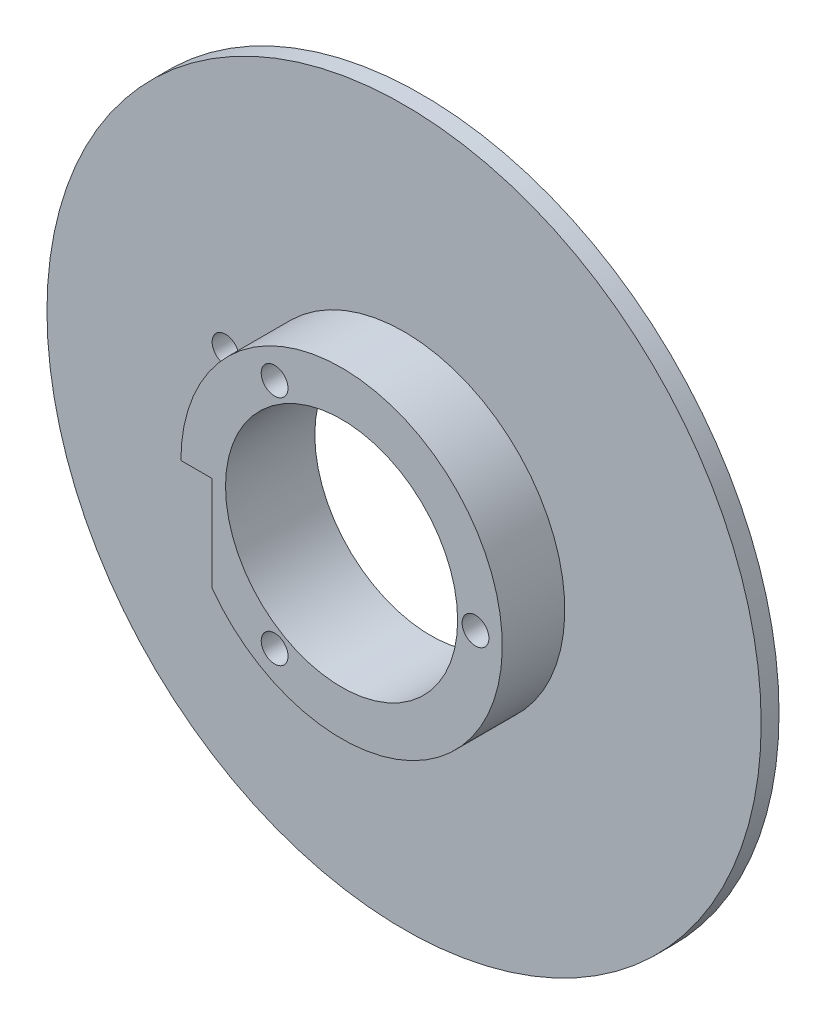
from build123d import *

# Parameters (mm, degrees)
SKETCH1_R           = 40
BOSS_EXTRUDE1_DEPTH = 5
SKETCH2_R           = 18
BOSS_EXTRUDE2_DEPTH = 7
CUT_EXTRUDE1_REACH  = 59.827
SKETCH3_R           = 13
SKETCH5_W           = 3.5
SKETCH5_H           = 10.665364504
CUT_EXTRUDE3_DEPTH  = 7
SKETCH6_R           = 1.25
CUT_EXTRUDE4_DEPTH  = 58
SKETCH8_R           = 1.5
CUT_EXTRUDE5_DEPTH  = 58.827329179
CIRPATTERN1_COUNT   = 3
SKETCH10_R          = 1.5
CUT_EXTRUDE6_DEPTH  = 58.827329179
SKETCH11_OUTSIDE_W  = 104.754
SKETCH11_OUTSIDE_H  = 104.754
SKETCH11_OUTSIDE_R  = 25
CUT_EXTRUDE8_DEPTH  = 3
SKETCH12_R          = 18
CUT_EXTRUDE9_DEPTH  = 2
SKETCH13_R          = 1
CUT_EXTRUDE10_DEPTH = 58.827329179


with BuildPart() as part:
    # Sketch1 → Boss-Extrude1 (new body)
    with BuildSketch(Plane.XY):
        Circle(SKETCH1_R)
    extrude(amount=BOSS_EXTRUDE1_DEPTH)

    # Sketch2 → Boss-Extrude2 (add)
    with BuildSketch(Plane.XY.offset(5)):
        Circle(SKETCH2_R)
    extrude(amount=BOSS_EXTRUDE2_DEPTH)

    # Sketch3 → Cut-Extrude1 (cut, up to next)
    with BuildSketch(Plane.XY.offset(12), mode=Mode.PRIVATE) as cut_extrude1_sk1:
        Circle(SKETCH3_R)
    cut_extrude1_tool1 = extrude(cut_extrude1_sk1.sketch, amount=-CUT_EXTRUDE1_REACH, mode=Mode.PRIVATE) & part.part
    add(cut_extrude1_tool1.solids().sort_by_distance((0, 0, 12))[0], mode=Mode.SUBTRACT)

    # Sketch5 → Cut-Extrude3 (cut)
    with BuildSketch(Plane.XY.offset(12)):
        with Locations((-16.25, -5.332682252)):
            Rectangle(SKETCH5_W, SKETCH5_H)
    extrude(amount=-CUT_EXTRUDE3_DEPTH, mode=Mode.SUBTRACT)

    # Sketch6 → Cut-Extrude4 (cut, through all)
    with BuildSketch(Plane.XY.offset(5)):
        with Locations((-16, -1.25)):
            Circle(SKETCH6_R)
    extrude(amount=-CUT_EXTRUDE4_DEPTH, mode=Mode.SUBTRACT)

    # Sketch8 → Cut-Extrude5 (cut, through all)
    with BuildSketch(Plane.XY.offset(12)):
        with Locations((15, 0)):
            Circle(SKETCH8_R)
    cut_extrude5 = extrude(amount=-CUT_EXTRUDE5_DEPTH, mode=Mode.SUBTRACT)

    # CirPattern1: Cut-Extrude5 ×3 about axis
    cirpattern1_axis = Axis((0, 0, 0), (0, 0, 1))
    for i in range(1, CIRPATTERN1_COUNT):
        add(cut_extrude5.rotate(cirpattern1_axis, i * 360 / CIRPATTERN1_COUNT), mode=Mode.SUBTRACT)

    # Sketch10 → Cut-Extrude6 (cut, through all)
    with BuildSketch(Plane(origin=(0, 0, 0), x_dir=(-1, 0, 0), z_dir=(0, 0, -1))):
        with Locations((20, 6.25)):
            Circle(SKETCH10_R)
        with Locations((20, -8.75)):
            Circle(SKETCH10_R)
    extrude(amount=-CUT_EXTRUDE6_DEPTH, mode=Mode.SUBTRACT)

    # Sketch11 outside → Cut-Extrude8 (cut)
    with BuildSketch(Plane(origin=(0, 0, 0), x_dir=(-1, 0, 0), z_dir=(0, 0, -1))):
        Rectangle(SKETCH11_OUTSIDE_W, SKETCH11_OUTSIDE_H)
        Circle(SKETCH11_OUTSIDE_R, mode=Mode.SUBTRACT)
    extrude(amount=-CUT_EXTRUDE8_DEPTH, mode=Mode.SUBTRACT)

    # Sketch12 → Cut-Extrude9 (cut)
    with BuildSketch(Plane(origin=(0, 0, 0), x_dir=(-1, 0, 0), z_dir=(0, 0, -1))):
        Circle(SKETCH12_R)
    extrude(amount=-CUT_EXTRUDE9_DEPTH, mode=Mode.SUBTRACT)

    # Sketch13 → Cut-Extrude10 (cut, through all)
    with BuildSketch(Plane.XZ):
        with Locations(Location((-16, 8, 0), (0, 0, 270))):
            Circle(SKETCH13_R)
    extrude(amount=-CUT_EXTRUDE10_DEPTH, mode=Mode.SUBTRACT)


solid = part.part
